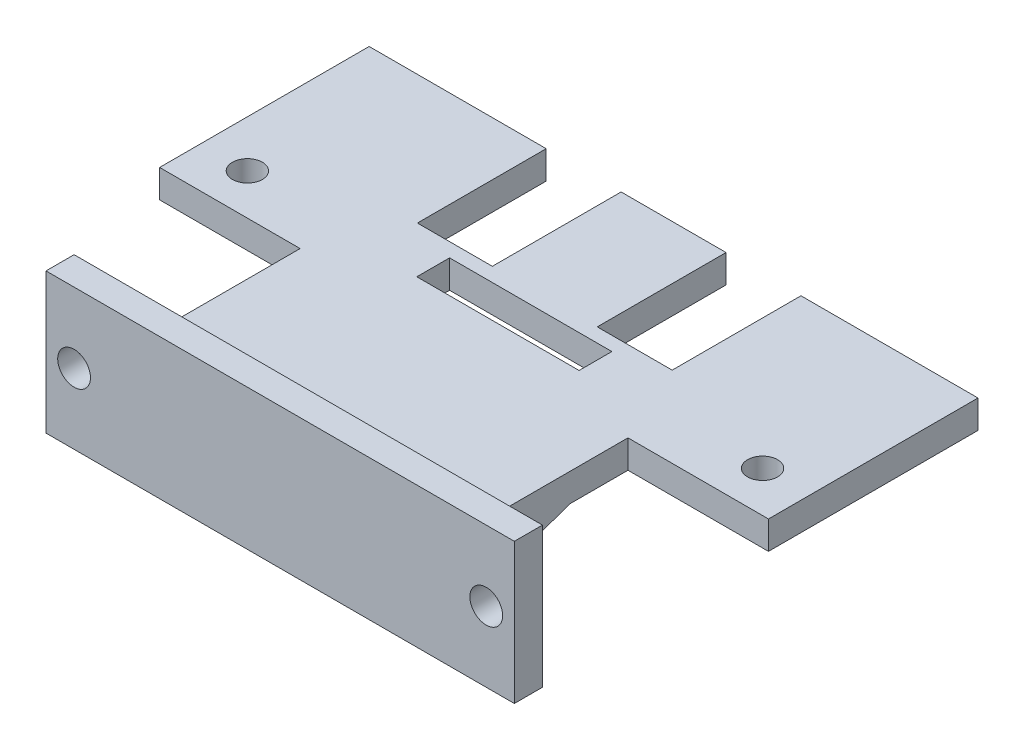
from build123d import *

# Parameters (mm, degrees)
SKETCH1_W                      = 50
SKETCH1_H                      = 15
BOSS_EXTRUDE1_DEPTH            = 3
SKETCH2_W                      = 35
SKETCH2_H                      = 3
BOSS_EXTRUDE2_DEPTH            = 47
SKETCH3_W                      = 30.36922738
SKETCH3_H                      = 3
BOSS_EXTRUDE3_DEPTH            = 15
SKETCH4_W                      = 30.36922738
SKETCH4_H                      = 3
BOSS_EXTRUDE4_DEPTH            = 15
CUT_EXTRUDE1_DEPTH             = 42.776189391
F_4_0_4_DIAMETER_HOLE1_D       = 3.5
F_4_0_4_DIAMETER_HOLE1_DEPTH   = 3
F_3_2_3_2_DIAMETER_HOLE1_D     = 3.2
F_3_2_3_2_DIAMETER_HOLE1_DEPTH = 11
CUT_EXTRUDE2_START             = -15
SKETCH14_W                     = 8
SKETCH14_H                     = 3
CUT_EXTRUDE2_DEPTH             = 72.471231614
SKETCH15_W                     = 17.327316674
SKETCH15_H                     = 3.5
CUT_EXTRUDE3_DEPTH             = 10
BOSS_EXTRUDE5_DEPTH            = 5


with BuildPart() as part:
    # Sketch1 → Boss-Extrude1 (new body)
    with BuildSketch(Plane.XY.offset(25)):
        with Locations((0, -0.5)):
            Rectangle(SKETCH1_W, SKETCH1_H)
    extrude(amount=-BOSS_EXTRUDE1_DEPTH)

    # Sketch2 → Boss-Extrude2 (add)
    with BuildSketch(Plane(origin=(0, 0, 22), x_dir=(-1, 0, 0), z_dir=(0, 0, -1))):
        with Locations((0, 1.5)):
            Rectangle(SKETCH2_W, SKETCH2_H)
    extrude(amount=BOSS_EXTRUDE2_DEPTH)

    # Sketch3 → Boss-Extrude3 (add)
    with BuildSketch(Plane(origin=(17.5, 0, 0), x_dir=(0, 0, -1), z_dir=(1, 0, 0))):
        with Locations((9.81538631, 1.5)):
            Rectangle(SKETCH3_W, SKETCH3_H)
    extrude(amount=BOSS_EXTRUDE3_DEPTH)

    # Sketch4 → Boss-Extrude4 (add)
    with BuildSketch(Plane.ZY.offset(17.5)):
        with Locations((-9.81538631, 1.5)):
            Rectangle(SKETCH4_W, SKETCH4_H)
    extrude(amount=BOSS_EXTRUDE4_DEPTH)

    # Sketch5 → Cut-Extrude1 (cut, through all)
    with BuildSketch(Plane.XZ):
        Polygon((17.5, -25), (17.5, -17), (13.6, -17), (13.6, -3.25), (5.6, -3.25), (5.6, -17), (-5.6, -17), (-5.6, -3.25), (-13.6, -3.25), (-13.6, -17), (-17.5, -17), (-17.5, -25), align=None)
    extrude(amount=-CUT_EXTRUDE1_DEPTH, mode=Mode.SUBTRACT)

    # Ø4.0 (4) Diameter Hole1
    with Locations(Plane.XY.offset(25)):
        with Locations((22, -0.5), (-22, -0.5)):
            Hole(F_4_0_4_DIAMETER_HOLE1_D / 2, depth=F_4_0_4_DIAMETER_HOLE1_DEPTH)

    # Ø3.2 (3.2) Diameter Hole1
    with Locations(Plane(origin=(0, 3, 0), x_dir=(1, 0, 0), z_dir=(0, 1, 0))):
        with Locations((-27.5, -1), (27.5, -1)):
            Hole(F_3_2_3_2_DIAMETER_HOLE1_D / 2, depth=F_3_2_3_2_DIAMETER_HOLE1_DEPTH)

    # Sketch14 → Cut-Extrude2 (cut, through all)
    with BuildSketch(Plane(origin=(-17.5, 0, 0), x_dir=(0, 0, -1), z_dir=(1, 0, 0)).offset(CUT_EXTRUDE2_START)):
        with Locations((21, 1.5)):
            Rectangle(SKETCH14_W, SKETCH14_H)
    extrude(amount=CUT_EXTRUDE2_DEPTH, mode=Mode.SUBTRACT)

    # Sketch15 → Cut-Extrude3 (cut)
    with BuildSketch(Plane(origin=(0, 3, 0), x_dir=(1, 0, 0), z_dir=(0, 1, 0))):
        Rectangle(SKETCH15_W, SKETCH15_H)
    extrude(amount=-CUT_EXTRUDE3_DEPTH, mode=Mode.SUBTRACT)

    # Sketch17 → Boss-Extrude5 (add)
    with BuildSketch(Plane(origin=(17.5, 0, 0), x_dir=(0, 0, -1), z_dir=(1, 0, 0))):
        Polygon((-22, -3.655953394), (-11.540106588, 0), (-22, 0), align=None)
    boss_extrude5 = extrude(amount=-BOSS_EXTRUDE5_DEPTH)

    # Mirror1: Boss-Extrude5 across plane
    add(boss_extrude5.mirror(Plane(origin=(0, 0, 0), x_dir=(0, 0, 1), z_dir=(1, 0, 0))))


solid = part.part
